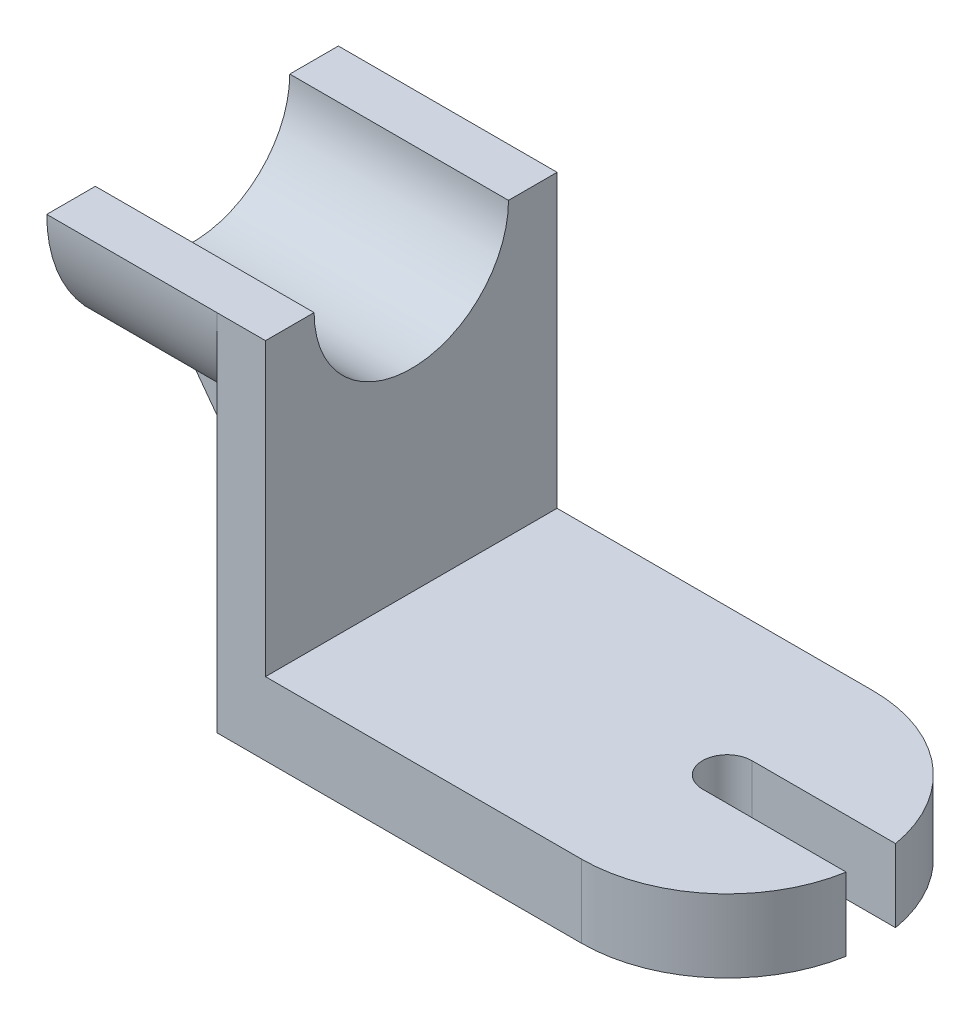
from build123d import *

# Parameters (mm, degrees)
BOSS_EXTRUDE1_DEPTH = 38.1
SKETCH2_W           = 152.4
SKETCH2_H           = 190.184169006
BOSS_EXTRUDE2_DEPTH = 25.4
SKETCH6_W           = 88.91318071
SKETCH6_H           = 25.4
REVOLVE1_ANGLE      = 180
BOSS_EXTRUDE3_DEPTH = 88.9
CUT_EXTRUDE1_DEPTH  = 88.9
SKETCH9_R           = 12.902875399
CUT_EXTRUDE2_DEPTH  = 88.9
CUT_EXTRUDE3_START  = -30.48
SKETCH11_R          = 50.8
CUT_EXTRUDE3_DEPTH  = 30.48


with BuildPart() as part:
    # Sketch1 → Boss-Extrude1 (new body)
    with BuildSketch(Plane(origin=(0, 0, 0), x_dir=(1, 0, 0), z_dir=(0, 1, 0))):
        with BuildLine():
            Line((95.25, -12.902875399), (95.25, 12.902875399))
            Line((95.25, 12.902875399), (170.34963919, 12.902875399))
            ThreePointArc((170.34963919, 12.902875399), (144.358252334, 58.265080046), (95.25, 76.2))
            Line((95.25, 76.2), (-95.25, 76.2))
            Line((-95.25, 76.2), (-95.25, -76.2))
            Line((-95.25, -76.2), (95.25, -76.2))
            ThreePointArc((95.25, -76.2), (144.358252334, -58.265080046), (170.34963919, -12.902875399))
            Line((170.34963919, -12.902875399), (95.25, -12.902875399))
        make_face()
    extrude(amount=BOSS_EXTRUDE1_DEPTH)

    # Sketch2 → Boss-Extrude2 (add)
    with BuildSketch(Plane.ZY.offset(95.25)):
        with Locations((0, 95.092084503)):
            Rectangle(SKETCH2_W, SKETCH2_H)
    extrude(amount=-BOSS_EXTRUDE2_DEPTH)

    # Sketch6 → Revolve1 (revolve)
    with BuildSketch(Plane(origin=(0, 190.184169006, 0), x_dir=(1, 0, 0), z_dir=(0, 1, 0))):
        with Locations((-139.706590355, 63.5)):
            Rectangle(SKETCH6_W, SKETCH6_H)
    revolve(axis=Axis((0, 190.184169006, 0), (-1, 0, 0)), revolution_arc=REVOLVE1_ANGLE)

    # Sketch7 → Boss-Extrude3 (add)
    with BuildSketch(Plane.ZY.offset(95.25)):
        Polygon((12.902875399, 0), (-12.902875399, 0), (-12.902875399, 115.084529816), (0, 113.984169006), (12.902875399, 115.084529816), align=None)
    extrude(amount=BOSS_EXTRUDE3_DEPTH)

    # Sketch8 → Cut-Extrude1 (cut)
    with BuildSketch(Plane.XY.offset(12.902875399)):
        Polygon((-98.890075703, 0), (-184.15, 0), (-184.15, 115.084529816), align=None)
    extrude(amount=-CUT_EXTRUDE1_DEPTH, mode=Mode.SUBTRACT)

    # Sketch9 → Cut-Extrude2 (cut)
    with BuildSketch(Plane(origin=(0, 38.1, 0), x_dir=(1, 0, 0), z_dir=(0, 1, 0))):
        with Locations((95.25, 0)):
            Circle(SKETCH9_R)
    extrude(amount=-CUT_EXTRUDE2_DEPTH, mode=Mode.SUBTRACT)

    # Sketch11 → Cut-Extrude3 (cut)
    with BuildSketch(Plane.ZY.offset(95.25).offset(CUT_EXTRUDE3_START)):
        with Locations((0, 190.184169006)):
            Circle(SKETCH11_R)
    extrude(amount=CUT_EXTRUDE3_DEPTH, mode=Mode.SUBTRACT)


solid = part.part
